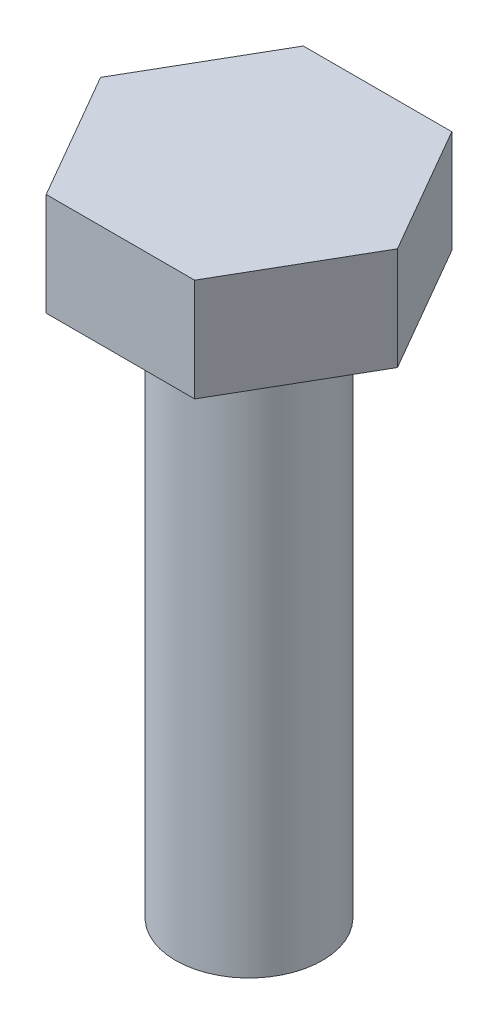
from build123d import *

# Parameters (mm, degrees)
SKETCH_1_R      = 2
EXTRUDE_1_DEPTH = 15
EXTRUDE_2_DEPTH = 2.8


with BuildPart() as part:
    # 草图1 → 凸台-拉伸1 (new body)
    with BuildSketch(Plane(origin=(0, 0, 0), x_dir=(1, 0, 0), z_dir=(0, 1, 0))):
        with Locations(Location((0, 0, 0), (0, 0, 270))):
            Circle(SKETCH_1_R)
    extrude(amount=EXTRUDE_1_DEPTH)

    # 草图2 → 凸台-拉伸2 (add)
    with BuildSketch(Plane(origin=(0, 15, 0), x_dir=(1, 0, 0), z_dir=(0, 1, 0))):
        Polygon((4.041451884, 0), (2.020725942, 3.5), (-2.020725942, 3.5), (-4.041451884, 0), (-2.020725942, -3.5), (2.020725942, -3.5), align=None)
    extrude(amount=EXTRUDE_2_DEPTH)


solid = part.part
